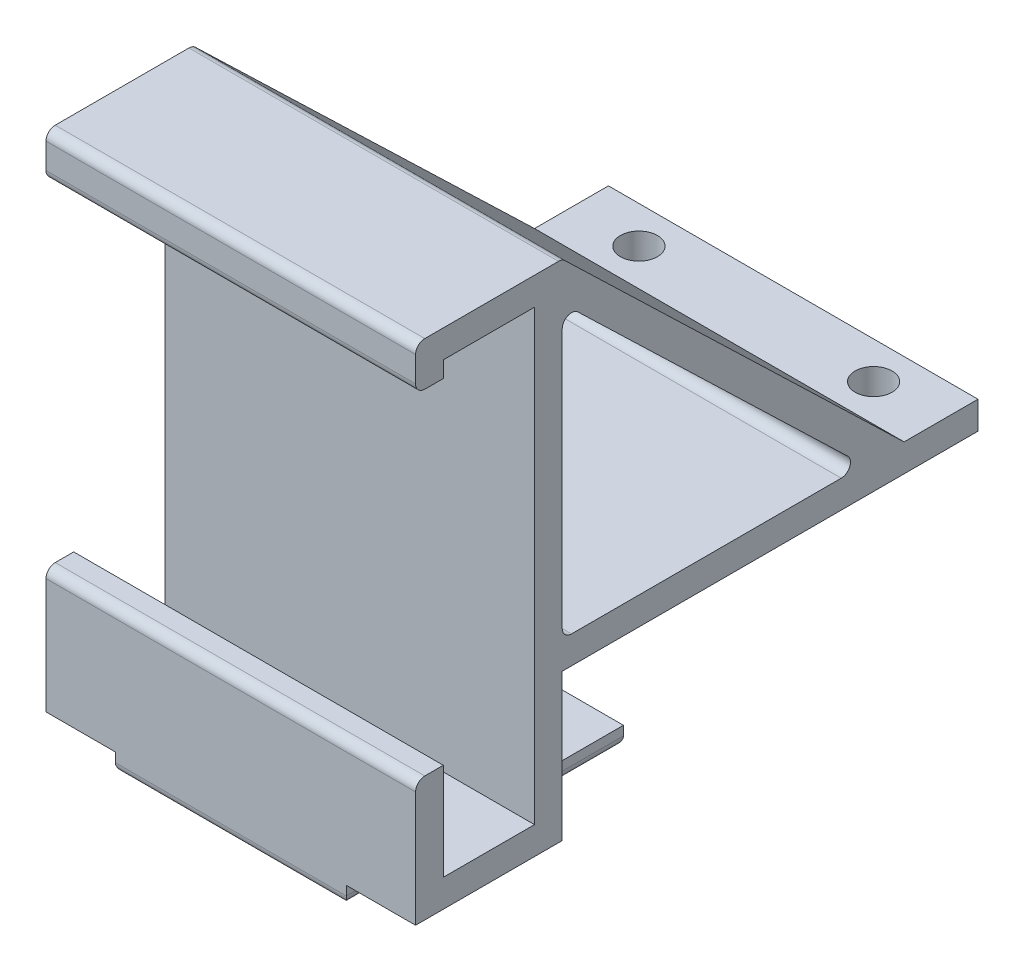
from build123d import *

# Parameters (mm, degrees)
SKETCH1_W                       = 36
SKETCH1_H                       = 36
BOSS_EXTRUDE1_DEPTH             = 13.5
SKETCH1_3_W                     = 40
SKETCH1_3_H                     = 48.5
BOSS_EXTRUDE2_DEPTH             = 10
FILLET1_R                       = 3.5
FILLET2_R                       = 3.5
FILLET3_R                       = 1
FILLET4_R                       = 1
FILLET5_R                       = 1
BOSS_EXTRUDE3_REACH             = 39.343
BOSS_EXTRUDE3_DIRECTION_2_REACH = 39.343
BOSS_EXTRUDE4_REACH             = 41.68
BOSS_EXTRUDE4_DIRECTION_2_REACH = 41.68
BOSS_EXTRUDE5_DEPTH             = 12.5
SKETCH9_R                       = 2
CUT_EXTRUDE3_DEPTH              = 71.944630699
FILLET6_R                       = 1
FILLET7_R                       = 1


with BuildPart() as part:
    # Sketch1 → Boss-Extrude1 (new body)
    with BuildSketch(Plane.XY):
        Rectangle(SKETCH1_W, SKETCH1_H)
    extrude(amount=BOSS_EXTRUDE1_DEPTH)

    # Fillet2
    fillet2_edges = [part.edges().sort_by_distance(p)[0] for p in [
        (18, 18, 6.75),
        (18, -18, 6.75),
        (-18, -18, 6.75),
        (-18, 18, 6.75),
    ]]
    fillet(fillet2_edges, radius=FILLET2_R)

    # Fillet5
    fillet5_edges = [part.edges().sort_by_distance(p)[0] for p in [
        (-16.974873734, 16.974873734, 13.5),
        (0, 18, 13.5),
        (16.974873734, 16.974873734, 13.5),
        (18, 0, 13.5),
        (16.974873734, -16.974873734, 13.5),
        (0, -18, 13.5),
        (-16.974873734, -16.974873734, 13.5),
        (-18, 0, 13.5),
    ]]
    fillet(fillet5_edges, radius=FILLET5_R)


with BuildPart() as body_2:
    # Sketch1<3> → Boss-Extrude2 (new body)
    with BuildSketch(Plane.XY):
        with Locations((0, -4.25)):
            Rectangle(SKETCH1_3_W, SKETCH1_3_H)
    extrude(amount=-BOSS_EXTRUDE2_DEPTH)

    # Fillet1
    fillet1_edges = [body_2.edges().sort_by_distance(p)[0] for p in [
        (20, 20, -5),
        (-20, -28.5, -5),
        (20, -28.5, -5),
        (-20, 20, -5),
    ]]
    fillet(fillet1_edges, radius=FILLET1_R)

    # Fillet3
    fillet3_edges = [body_2.edges().sort_by_distance(p)[0] for p in [
        (-18.974873734, 18.974873734, 0),
        (0, 20, 0),
        (18.974873734, 18.974873734, 0),
        (20, -4.25, 0),
        (18.974873734, -27.474873734, 0),
        (0, -28.5, 0),
        (-18.974873734, -27.474873734, 0),
        (-20, -4.25, 0),
    ]]
    fillet(fillet3_edges, radius=FILLET3_R)

    # Fillet4
    fillet4_edges = [body_2.edges().sort_by_distance(p)[0] for p in [
        (-18.974873734, 18.974873734, -10),
        (-20, -4.25, -10),
        (-18.974873734, -27.474873734, -10),
        (0, -28.5, -10),
        (18.974873734, -27.474873734, -10),
        (20, -4.25, -10),
        (18.974873734, 18.974873734, -10),
        (0, 20, -10),
    ]]
    fillet(fillet4_edges, radius=FILLET4_R)


with BuildPart() as body_3:

    # Boss-Extrude3: up to this face of the body (flat: up to its plane)
    boss_extrude3_end = Plane(body_2.part.faces().sort_by_distance((20, -4.25, -5))[0])
    # Sketch2 → Boss-Extrude3 (new, up to the picked face)
    with BuildSketch(Plane(origin=(0, 0, 0), x_dir=(0, 0, -1), z_dir=(1, 0, 0)), mode=Mode.PRIVATE) as boss_extrude3_sk1:
        Polygon((-2.875, -18), (-2.875, -31.5), (13, -31.5), (13, 20), (13, 23), (-2.875, 23), (-2.875, 18.25), (0.125, 18.25), (0.125, 20), (10, 20), (10, -28.5), (0.125, -28.5), (0.125, -18), align=None)
    boss_extrude3_tool1 = split(extrude(boss_extrude3_sk1.sketch, amount=BOSS_EXTRUDE3_REACH, mode=Mode.PRIVATE), bisect_by=boss_extrude3_end, keep=Keep.BOTH, mode=Mode.PRIVATE)
    add(boss_extrude3_tool1.solids().sort_by(Axis((0, -24.75, 2.30735), (1, 0, 0)))[0])


    # Boss-Extrude3 direction 2: up to this face of the body (flat: up to its plane)
    boss_extrude3_direction_2_end = Plane(body_2.part.faces().sort_by_distance((-20, -4.25, -5))[0])
    # Sketch2 → Boss-Extrude3 direction 2 (add, up to the picked face)
    with BuildSketch(Plane(origin=(0, 0, 0), x_dir=(0, 0, -1), z_dir=(1, 0, 0)), mode=Mode.PRIVATE) as boss_extrude3_direction_2_sk1:
        Polygon((-2.875, -18), (-2.875, -31.5), (13, -31.5), (13, 20), (13, 23), (-2.875, 23), (-2.875, 18.25), (0.125, 18.25), (0.125, 20), (10, 20), (10, -28.5), (0.125, -28.5), (0.125, -18), align=None)
    boss_extrude3_direction_2_tool1 = split(extrude(boss_extrude3_direction_2_sk1.sketch, amount=-BOSS_EXTRUDE3_DIRECTION_2_REACH, mode=Mode.PRIVATE), bisect_by=boss_extrude3_direction_2_end, keep=Keep.BOTH, mode=Mode.PRIVATE)
    add(boss_extrude3_direction_2_tool1.solids().sort_by(Axis((0, -24.75, 2.30735), (-1, 0, 0)))[0])


    # Boss-Extrude4: up to this face of the body (flat: up to its plane)
    boss_extrude4_end = Plane(body_2.part.faces().sort_by_distance((20, -4.25, -5))[0])
    # Sketch3 → Boss-Extrude4 (add, up to the picked face)
    with BuildSketch(Plane(origin=(0, 0, 0), x_dir=(0, 0, -1), z_dir=(1, 0, 0)), mode=Mode.PRIVATE) as boss_extrude4_sk1:
        Polygon((58, -15.625), (10, -15.625), (10, 23), (13, 23), (50, -12.625), (58, -12.625), align=None)
        Polygon((13, 18.835445964), (13, -12.625), (45.674708791, -12.625), align=None, mode=Mode.SUBTRACT)
    boss_extrude4_tool1 = split(extrude(boss_extrude4_sk1.sketch, amount=BOSS_EXTRUDE4_REACH, mode=Mode.PRIVATE), bisect_by=boss_extrude4_end, keep=Keep.BOTH, mode=Mode.PRIVATE)
    add(boss_extrude4_tool1.solids().sort_by(Axis((0, -15.008892, -34), (1, 0, 0)))[0])


    # Boss-Extrude4 direction 2: up to this face of the body (flat: up to its plane)
    boss_extrude4_direction_2_end = Plane(body_2.part.faces().sort_by_distance((-20, -4.25, -5))[0])
    # Sketch3 → Boss-Extrude4 direction 2 (add, up to the picked face)
    with BuildSketch(Plane(origin=(0, 0, 0), x_dir=(0, 0, -1), z_dir=(1, 0, 0)), mode=Mode.PRIVATE) as boss_extrude4_direction_2_sk1:
        Polygon((58, -15.625), (10, -15.625), (10, 23), (13, 23), (50, -12.625), (58, -12.625), align=None)
        Polygon((13, 18.835445964), (13, -12.625), (45.674708791, -12.625), align=None, mode=Mode.SUBTRACT)
    boss_extrude4_direction_2_tool1 = split(extrude(boss_extrude4_direction_2_sk1.sketch, amount=-BOSS_EXTRUDE4_DIRECTION_2_REACH, mode=Mode.PRIVATE), bisect_by=boss_extrude4_direction_2_end, keep=Keep.BOTH, mode=Mode.PRIVATE)
    add(boss_extrude4_direction_2_tool1.solids().sort_by(Axis((0, -15.008892, -34), (-1, 0, 0)))[0])

    # Sketch8 → Boss-Extrude5 (add, symmetric)
    with BuildSketch(Plane(origin=(0, 0, 0), x_dir=(0, 0, -1), z_dir=(1, 0, 0))):
        Polygon((-2.875, -31.5), (-2.875, -33.5), (27.125, -33.5), (27.125, -31.5), (13, -31.5), align=None)
    extrude(amount=BOSS_EXTRUDE5_DEPTH, both=True)

    # Sketch9 → Cut-Extrude3 (cut, through all)
    with BuildSketch(Plane(origin=(0, -12.625, 0), x_dir=(1, 0, 0), z_dir=(0, 1, 0))):
        with Locations((12.7, 54)):
            Circle(SKETCH9_R)
        with Locations((-12.7, 54)):
            Circle(SKETCH9_R)
    extrude(amount=-CUT_EXTRUDE3_DEPTH, mode=Mode.SUBTRACT)

    # Fillet6
    fillet6_edges = [body_3.edges().sort_by_distance(p)[0] for p in [
        (0, -12.625, -45.674708791),
        (0, -12.625, -13),
        (0, 18.835445964, -13),
        (0, -18, 2.875),
        (0, 18.25, 2.875),
        (0, 23, 2.875),
        (0, 23, -13),
    ]]
    fillet(fillet6_edges, radius=FILLET6_R)

    # Fillet7
    fillet7_edges = [body_3.edges().sort_by_distance(p)[0] for p in [
        (0, -33.5, 2.875),
        (12.5, -33.5, -12.125),
        (0, -33.5, -27.125),
        (-12.5, -33.5, -12.125),
    ]]
    fillet(fillet7_edges, radius=FILLET7_R)


solid = body_3.part
